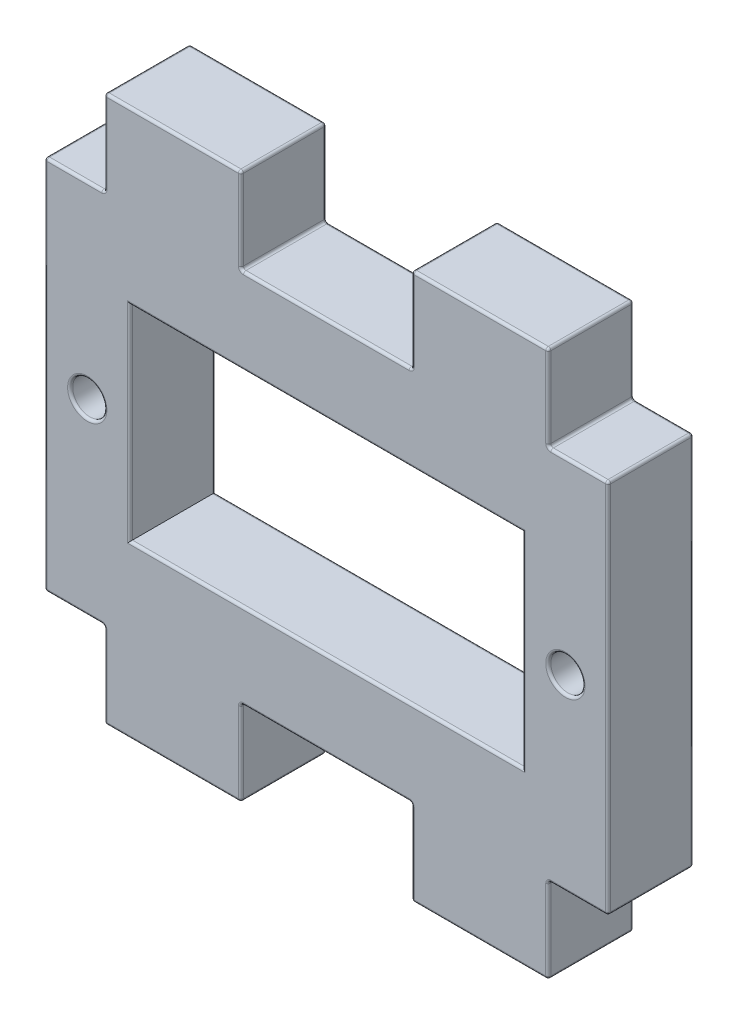
from build123d import *

# Parameters (mm, degrees)
SKETCH1_W           = 8
SKETCH1_H           = 5
SKETCH1_W_2         = 33
SKETCH1_H_2         = 22
SKETCH1_R           = 1
SKETCH1_W_3         = 23
SKETCH1_H_3         = 12
BOSS_EXTRUDE1_DEPTH = 5
FILLET1_R           = 0.15
FILLET2_R           = 0.15


with BuildPart() as part:
    # Sketch1 → Boss-Extrude1 (new body)
    # profile 1 of 5: a face of its own
    with BuildSketch(Plane.XY):
        with Locations((-9, 13.5)):
            Rectangle(SKETCH1_W, SKETCH1_H)
    # profile 2 of 5: a face of its own
    with BuildSketch(Plane.XY):
        with Locations((9, 13.5)):
            Rectangle(SKETCH1_W, SKETCH1_H)
    # profile 3 of 5: a face of its own
    with BuildSketch(Plane.XY):
        Rectangle(SKETCH1_W_2, SKETCH1_H_2)
        with Locations((14, 0)):
            Circle(SKETCH1_R, mode=Mode.SUBTRACT)
        with Locations((-14, 0)):
            Circle(SKETCH1_R, mode=Mode.SUBTRACT)
        Rectangle(SKETCH1_W_3, SKETCH1_H_3, mode=Mode.SUBTRACT)
    # profile 4 of 5: a face of its own
    with BuildSketch(Plane.XY):
        with Locations((9, -13.5)):
            Rectangle(SKETCH1_W, SKETCH1_H)
    # profile 5 of 5: a face of its own
    with BuildSketch(Plane.XY):
        with Locations((-9, -13.5)):
            Rectangle(SKETCH1_W, SKETCH1_H)
    extrude(amount=BOSS_EXTRUDE1_DEPTH)

    # Fillet1
    fillet1_edges = [part.edges().sort_by_distance(p)[0] for p in [
        (-5, 13.5, 5),
        (-9, 16, 5),
        (-14.75, 11, 5),
        (-16.5, 0, 5),
        (-14.75, -11, 5),
        (-9, 16, 0),
        (-13, -13.5, 5),
        (-5, 13.5, 0),
        (0, 11, 0),
        (5, 13.5, 0),
        (9, 16, 0),
        (13, 13.5, 0),
        (14.75, 11, 0),
        (16.5, 0, 0),
        (14.75, -11, 0),
        (-9, -16, 5),
        (13, -13.5, 0),
        (9, -16, 0),
        (5, -13.5, 0),
        (0, -11, 0),
        (-5, -13.5, 0),
        (-9, -16, 0),
        (-13, -13.5, 0),
        (-14.75, -11, 0),
        (-16.5, 0, 0),
        (-14.75, 11, 0),
        (-5, -13.5, 5),
        (-13, 13.5, 0),
        (0, -11, 5),
        (-13, 16, 2.5),
        (-5, 16, 2.5),
        (-5, 11, 2.5),
        (5, 11, 2.5),
        (5, 16, 2.5),
        (13, 16, 2.5),
        (13, 11, 2.5),
        (16.5, 11, 2.5),
        (16.5, -11, 2.5),
        (13, -11, 2.5),
        (13, -16, 2.5),
        (5, -16, 2.5),
        (5, -11, 2.5),
        (-5, -11, 2.5),
        (5, -13.5, 5),
        (-5, -16, 2.5),
        (-13, -16, 2.5),
        (-13, -11, 2.5),
        (-16.5, -11, 2.5),
        (-16.5, 11, 2.5),
        (-13, 11, 2.5),
        (9, -16, 5),
        (13, -13.5, 5),
        (14.75, -11, 5),
        (16.5, 0, 5),
        (14.75, 11, 5),
        (-13, 13.5, 5),
        (13, 13.5, 5),
        (9, 16, 5),
        (5, 13.5, 5),
        (0, 11, 5),
    ]]
    fillet(fillet1_edges, radius=FILLET1_R)

    # Fillet2
    fillet2_edges = [part.edges().sort_by_distance(p)[0] for p in [
        (11.5, 0, 5),
        (0, -6, 5),
        (-11.5, 0, 5),
        (0, 6, 5),
        (13, 0, 5),
        (-15, 0, 5),
        (-15, 0, 0),
        (13, 0, 0),
        (0, 6, 0),
        (-11.5, 0, 0),
        (0, -6, 0),
        (11.5, 0, 0),
    ]]
    fillet(fillet2_edges, radius=FILLET2_R)


solid = part.part
